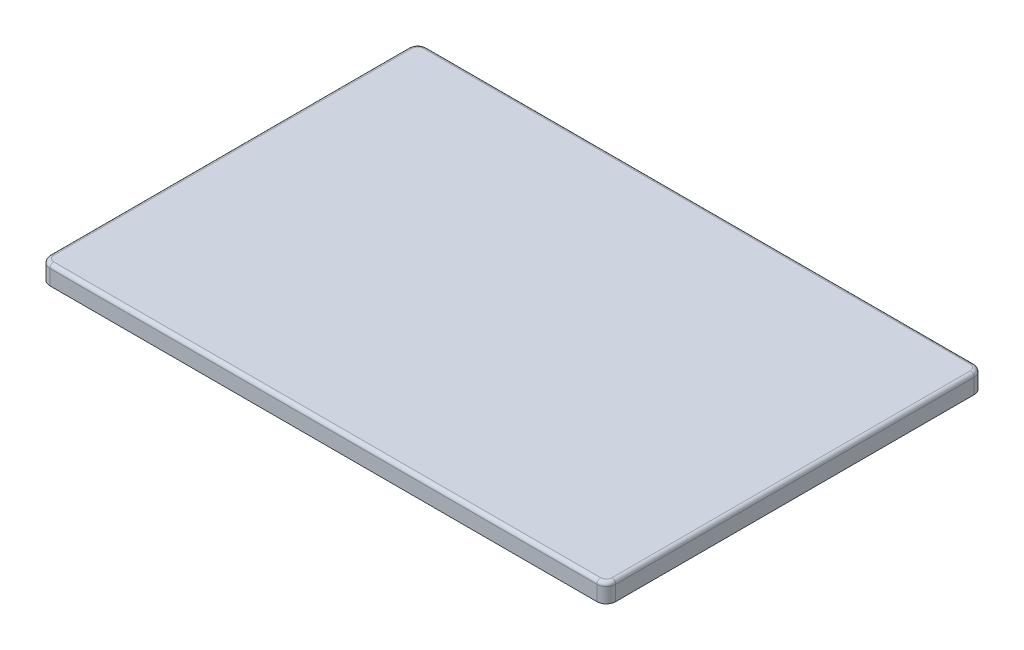
from build123d import *

# Parameters (mm, degrees)
BOSS_EXTRUDE1_DEPTH = 10
SHELL1_T            = -3
FILLET1_R           = 2


with BuildPart() as part:
    # Sketch1 → Boss-Extrude1 (new body)
    with BuildSketch(Plane(origin=(0, 0, 0), x_dir=(1, 0, 0), z_dir=(0, 1, 0))):
        with BuildLine():
            Line((-145, 100), (145, 100))
            ThreePointArc((145, 100), (148.535533906, 98.535533906), (150, 95))
            Line((150, 95), (150, -95))
            ThreePointArc((150, -95), (148.535533906, -98.535533906), (145, -100))
            Line((145, -100), (-145, -100))
            ThreePointArc((-145, -100), (-148.535533906, -98.535533906), (-150, -95))
            Line((-150, -95), (-150, 95))
            ThreePointArc((-150, 95), (-148.535533906, 98.535533906), (-145, 100))
        make_face()
    extrude(amount=BOSS_EXTRUDE1_DEPTH)

    # Shell1
    shell1_openings = [part.faces().sort_by_distance(p)[0] for p in [
        (0, 0, 0),
    ]]
    offset(amount=SHELL1_T, openings=shell1_openings, kind=Kind.INTERSECTION)

    # Fillet1
    fillet1_edges = [part.edges().sort_by_distance(p)[0] for p in [
        (-148.535533906, 10, -98.535533906),
        (-150, 10, 0),
        (-148.535533906, 10, 98.535533906),
        (0, 10, 100),
        (148.535533906, 10, 98.535533906),
        (150, 10, 0),
        (148.535533906, 10, -98.535533906),
        (0, 10, -100),
    ]]
    fillet(fillet1_edges, radius=FILLET1_R)


solid = part.part
